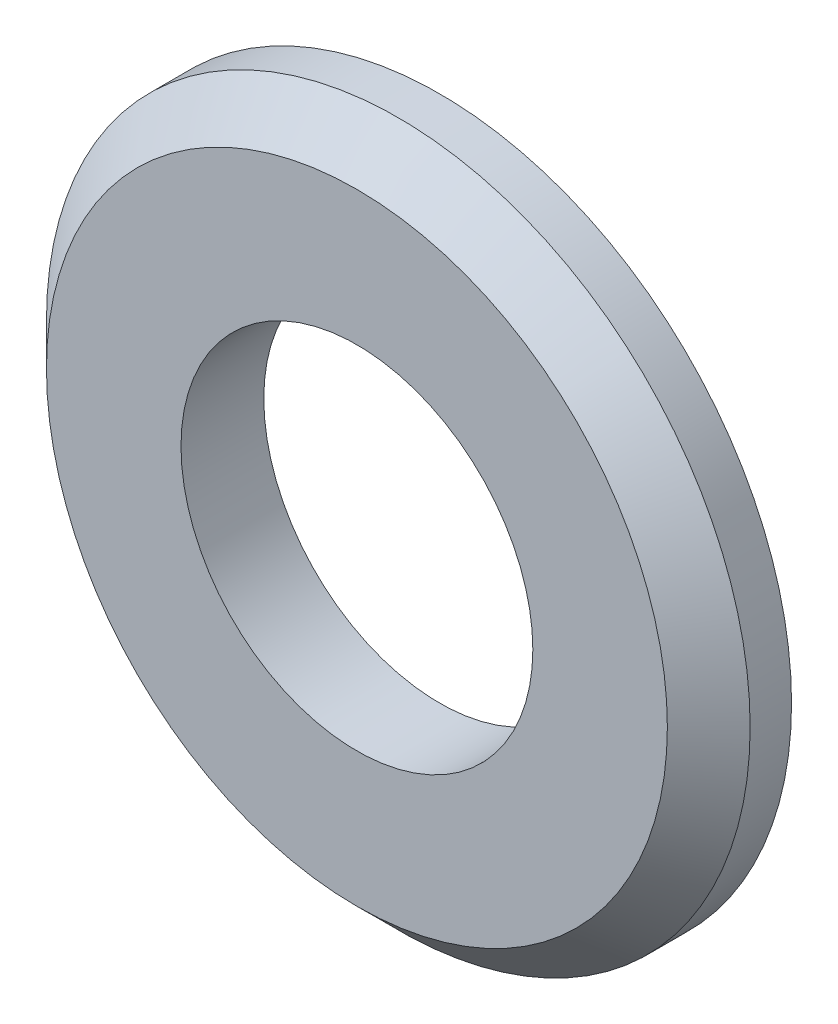
from build123d import *

# Parameters (mm, degrees)
CROQUIS1_R              = 8.5
CROQUIS1_R_2            = 4.25
SALIENTE_EXTRUIR1_DEPTH = 2
CHAFL_N1_SIZE           = 1


with BuildPart() as part:
    # Croquis1 → Saliente-Extruir1 (new body)
    with BuildSketch(Plane.XY):
        Circle(CROQUIS1_R)
        Circle(CROQUIS1_R_2, mode=Mode.SUBTRACT)
    extrude(amount=SALIENTE_EXTRUIR1_DEPTH)

    # Chaflán1
    chafl_n1_edges = [part.edges().sort_by_distance(p)[0] for p in [
        (-8.5, 0, 2),
    ]]
    chamfer(chafl_n1_edges, length=CHAFL_N1_SIZE)


solid = part.part
